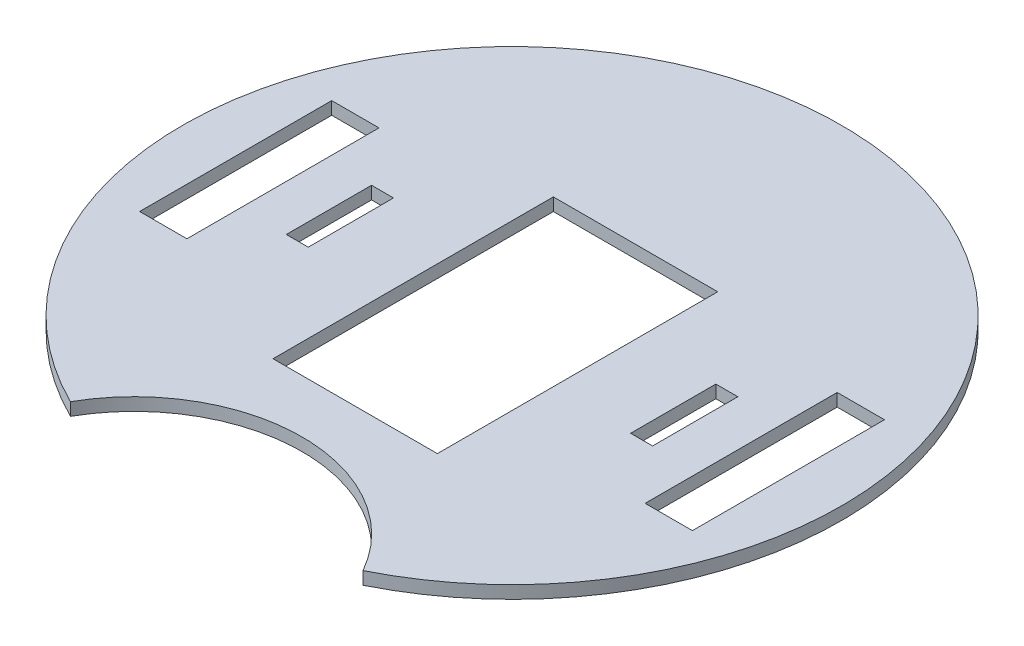
from build123d import *

# Parameters (mm, degrees)
BOSS_EXTRUDE1_DEPTH  = 2.9
SOLENOID_PLACEMENT_W = 37.4
SOLENOID_PLACEMENT_H = 63.8
CUT_EXTRUDE1_DEPTH   = 107.105654892
SKETCH2_W            = 10.76
SKETCH2_H            = 43.707605188
CUT_EXTRUDE2_DEPTH   = 107.105654892
SKETCH3_W            = 5
SKETCH3_H            = 19.4
CUT_EXTRUDE3_DEPTH   = 107.105654892


with BuildPart() as part:
    # Sketch1 → Boss-Extrude1 (new body)
    with BuildSketch(Plane(origin=(0, 0, 0), x_dir=(1, 0, 0), z_dir=(0, 1, 0))):
        with BuildLine():
            ThreePointArc((33.29110537, -67.206415641), (0, 75), (-33.29110537, -67.206415641))
            ThreePointArc((-33.29110537, -67.206415641), (0, -47.791616815), (33.29110537, -67.206415641))
        make_face()
    extrude(amount=BOSS_EXTRUDE1_DEPTH)

    # solenoid placement → Cut-Extrude1 (cut, through all)
    with BuildSketch(Plane(origin=(0, 2.9, 0), x_dir=(1, 0, 0), z_dir=(0, 1, 0))):
        with Locations((0, -3.8)):
            Rectangle(SOLENOID_PLACEMENT_W, SOLENOID_PLACEMENT_H)
    extrude(amount=-CUT_EXTRUDE1_DEPTH, mode=Mode.SUBTRACT)

    # Sketch2 → Cut-Extrude2 (cut, through all)
    with BuildSketch(Plane(origin=(0, 2.9, 0), x_dir=(1, 0, 0), z_dir=(0, 1, 0))):
        with Locations((57.517491988, 0)):
            Rectangle(SKETCH2_W, SKETCH2_H)
        with Locations((-57.517491988, 0)):
            Rectangle(SKETCH2_W, SKETCH2_H)
    extrude(amount=-CUT_EXTRUDE2_DEPTH, mode=Mode.SUBTRACT)

    # Sketch3 → Cut-Extrude3 (cut, through all)
    with BuildSketch(Plane(origin=(0, 2.9, 0), x_dir=(1, 0, 0), z_dir=(0, 1, 0))):
        with Locations((-39.179852803, 0)):
            Rectangle(SKETCH3_W, SKETCH3_H)
        with Locations((39.179852803, 0)):
            Rectangle(SKETCH3_W, SKETCH3_H)
    extrude(amount=-CUT_EXTRUDE3_DEPTH, mode=Mode.SUBTRACT)


solid = part.part
